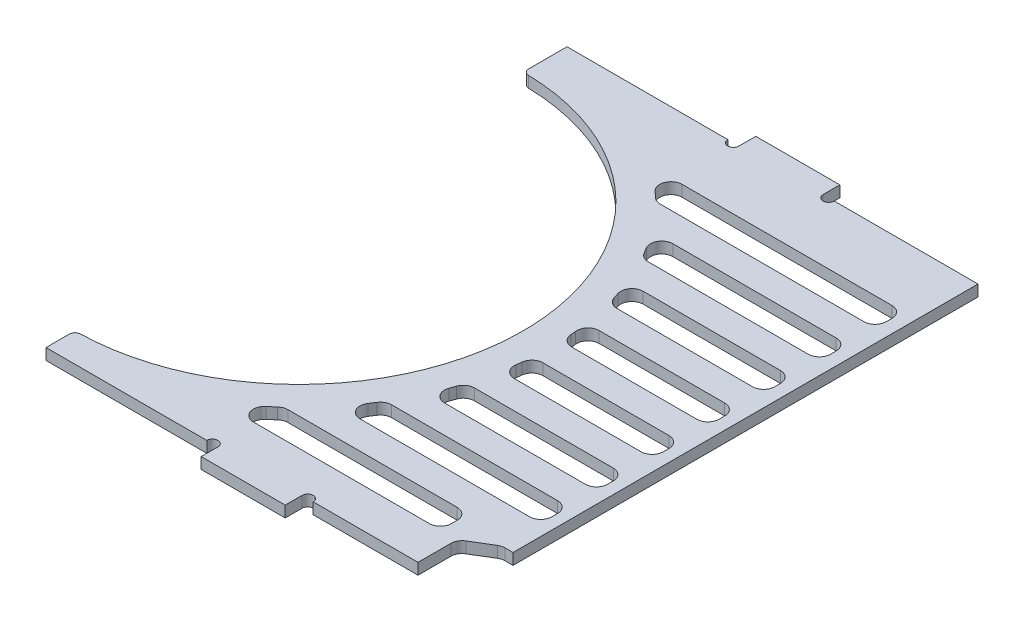
from build123d import *

# Parameters (mm, degrees)
EXTRUDE_1_DEPTH          = 2
SKETCH_3_W               = 76.4
SKETCH_3_H               = 2
EXTRUDE_2_DEPTH          = 7
CUT_EXTRUDE_1_DEPTH      = 10
EXTRUDE_4_DEPTH          = 2
PATTERN_LINEAR_2_COUNT   = 2
PATTERN_LINEAR_2_PITCH   = 32
FILLET_3_R               = 0.5
CUT_EXTRUDE_2_DEPTH      = 10
EXTRUDE_5_DEPTH          = 2
CUT_EXTRUDE_3_DEPTH      = 10
CUT_EXTRUDE_4_DEPTH      = 10
FILLET_5_R               = 2
EXTRUDE_9_DEPTH          = 2
FILLET_6_R               = 2
FILLET_7_R               = 1
SKETCH_18_W              = 76.4
SKETCH_18_H              = 2
EXTRUDE_6_DEPTH          = 2
SKETCH_19_W              = 10
SKETCH_19_H              = 10
CUT_EXTRUDE_5_DEPTH      = 63.552223465
EXTRUDE_8_DEPTH          = 2
FILLET_8_R               = 2
FILLET_9_R               = 2
SKETCH_21_W              = 3
SKETCH_21_H              = 87.342834434
CUT_EXTRUDE_6_DEPTH      = 63.552223465
CUT_EXTRUDE_7_DEPTH      = 63.484063073
CUT_EXTRUDE_7_DEPTH_BACK = 63.484063073
SKETCH_24_W              = 15
SKETCH_24_H              = 2
EXTRUDE_10_DEPTH         = 3
SKETCH_25_R              = 1
CUT_EXTRUDE_8_DEPTH      = 62.495223392


with BuildPart() as part:
    # 草图1 → 凸台-拉伸1 (new body)
    with BuildSketch(Plane(origin=(0, 0, 0), x_dir=(1, 0, 0), z_dir=(0, 1, 0))):
        with BuildLine():
            Line((-38.2, -42.69), (-38.2, -45.85))
            Line((-38.2, -45.85), (38.2, -45.85))
            Line((38.2, -45.85), (38.2, 45.85))
            Line((38.2, 45.85), (-38.2, 45.85))
            Line((-38.2, 45.85), (-38.2, 37.31))
            ThreePointArc((-38.2, 37.31), (1.8, -2.69), (-38.2, -42.69))
        make_face()
    extrude(amount=EXTRUDE_1_DEPTH)

    # 草图3 → 凸台-拉伸2 (add)
    with BuildSketch(Plane(origin=(0, 0, -45.85), x_dir=(-1, 0, 0), z_dir=(0, 0, -1))):
        with Locations((0, 1)):
            Rectangle(SKETCH_3_W, SKETCH_3_H)
    extrude(amount=EXTRUDE_2_DEPTH)

    # 草图5 → 切除-拉伸1 (cut)
    with BuildSketch(Plane(origin=(0, 2, 0), x_dir=(1, 0, 0), z_dir=(0, 1, 0))):
        Polygon((-38.2, 51.26), (38.2, 52.85), (-38.2, 52.85), align=None)
    extrude(amount=-CUT_EXTRUDE_1_DEPTH, mode=Mode.SUBTRACT)

    # 草图7 → 凸台-拉伸4 (add)
    with BuildSketch(Plane.XZ):
        Polygon((25.6, -52.587774869), (25.6, -54.754790576), (9.6, -54.754790576), (9.6, -52.254790576), align=None)
    extrude_4 = extrude(amount=-EXTRUDE_4_DEPTH)

    # 阵列(线性)2: 凸台-拉伸4 ×2
    with Locations(*[Vector(-0.9997835106742528, 0, 0.0208070128530375) * (i * PATTERN_LINEAR_2_PITCH) for i in range(1, PATTERN_LINEAR_2_COUNT)]):
        add(extrude_4)

    # 圆角3
    fillet_3_edges = [part.edges().sort_by_distance(p)[0] for p in [
        (25.6, 1, -54.754790576),
        (9.6, 1, -54.754790576),
        (-6.393072342, 1, -54.088966165),
        (-22.393072342, 1, -54.088966165),
    ]]
    fillet(fillet_3_edges, radius=FILLET_3_R)

    # 草图10 → 切除-拉伸2 (cut)
    with BuildSketch(Plane(origin=(0, 2, 0), x_dir=(1, 0, 0), z_dir=(0, 1, 0))):
        Polygon((-38.882265213, 53.905585721), (39.585789662, 55.538625083), (39.585789662, 48.538625083), (-38.2, 46.919784696), (-39.22769149, 52.889737929), align=None)
    extrude(amount=-CUT_EXTRUDE_2_DEPTH, mode=Mode.SUBTRACT)

    # 草图11 → 凸台-拉伸5 (add)
    with BuildSketch(Plane(origin=(0, 2, 0), x_dir=(1, 0, 0), z_dir=(0, 1, 0))):
        Polygon((-38.2, 46.919784696), (38.2, 49.509784696), (38.2, 48.509784696), align=None)
    extrude(amount=-EXTRUDE_5_DEPTH)

    # 草图13 → 切除-拉伸3 (cut)
    with BuildSketch(Plane.XZ):
        Polygon((38.2, -49.509784696), (37.7, -49.492834434), (38.2, 45.85), align=None)
    extrude(amount=-CUT_EXTRUDE_3_DEPTH, mode=Mode.SUBTRACT)

    # 草图16 → 切除-拉伸4 (cut)
    with BuildSketch(Plane.XZ):
        with BuildLine():
            ThreePointArc((-21.63159016, -39.14883119), (-26.948214114, -40.880601492), (-32.438562967, -41.939652064))
            Line((-32.438562967, -41.939652064), (32.727956442, -44.14883119))
            Line((32.727956442, -44.14883119), (32.754177605, -39.14883119))
            Line((32.754177605, -39.14883119), (-21.63159016, -39.14883119))
        make_face()
        with BuildLine():
            ThreePointArc((-6.399232266, -29.14883119), (-9.26951053, -31.777764346), (-12.35622867, -34.14883119))
            Line((-12.35622867, -34.14883119), (32.780398767, -34.14883119))
            Line((32.780398767, -34.14883119), (32.80661993, -29.14883119))
            Line((32.80661993, -29.14883119), (-6.399232266, -29.14883119))
        make_face()
        with BuildLine():
            ThreePointArc((1.145462918, -19.14883119), (-0.38438284, -21.702193399), (-2.079685213, -24.14883119))
            Line((-2.079685213, -24.14883119), (32.832841093, -24.14883119))
            Line((32.832841093, -24.14883119), (32.859062256, -19.14883119))
            Line((32.859062256, -19.14883119), (1.145462918, -19.14883119))
        make_face()
        with BuildLine():
            ThreePointArc((5.214767949, -9.14883119), (4.446089194, -11.673532869), (3.530729255, -14.14883119))
            Line((3.530729255, -14.14883119), (32.885283419, -14.14883119))
            Line((32.885283419, -14.14883119), (32.911504582, -9.14883119))
            Line((32.911504582, -9.14883119), (5.214767949, -9.14883119))
        make_face()
        with BuildLine():
            Line((32.937725745, -4.14883119), (32.963946908, 0.85116881))
            Line((32.963946908, 0.85116881), (6.762414302, 0.85116881))
            ThreePointArc((6.762414302, 0.85116881), (6.58968308, -1.65560578), (6.277301941, -4.14883119))
            Line((6.277301941, -4.14883119), (32.937725745, -4.14883119))
        make_face()
        with BuildLine():
            Line((33.016389234, 10.85116881), (6.053760559, 10.85116881))
            ThreePointArc((6.053760559, 10.85116881), (6.441352349, 8.360067057), (6.688829476, 5.85116881))
            Line((6.688829476, 5.85116881), (32.990168071, 5.85116881))
            Line((32.990168071, 5.85116881), (33.016389234, 10.85116881))
        make_face()
        with BuildLine():
            Line((33.06883156, 20.85116881), (2.97246589, 20.85116881))
            ThreePointArc((2.97246589, 20.85116881), (3.976569254, 18.378754125), (4.832355682, 15.85116881))
            Line((4.832355682, 15.85116881), (33.042610397, 15.85116881))
            Line((33.042610397, 15.85116881), (33.06883156, 20.85116881))
        make_face()
        with BuildLine():
            Line((33.121273886, 30.85116881), (-3.100875064, 30.85116881))
            ThreePointArc((-3.100875064, 30.85116881), (-1.274777634, 28.410185715), (0.381864384, 25.85116881))
            Line((0.381864384, 25.85116881), (33.095052723, 25.85116881))
            Line((33.095052723, 25.85116881), (33.121273886, 30.85116881))
        make_face()
        with BuildLine():
            Line((33.173710083, 40.85), (-14.350169812, 40.85))
            ThreePointArc((-14.350169812, 40.85), (-10.950539992, 38.501547429), (-7.780649528, 35.85116881))
            Line((-7.780649528, 35.85116881), (33.147495049, 35.85116881))
            Line((33.147495049, 35.85116881), (33.173710083, 40.85))
        make_face()
    extrude(amount=-CUT_EXTRUDE_4_DEPTH, mode=Mode.SUBTRACT)

    # 圆角5
    fillet_5_edges = [part.edges().sort_by_distance(p)[0] for p in [
        (-21.63159016, 1, -39.14883119),
        (32.754177605, 1, -39.14883119),
        (32.727956442, 1, -44.14883119),
        (-6.399232266, 1, -29.14883119),
        (32.80661993, 1, -29.14883119),
        (32.780398767, 1, -34.14883119),
        (-2.079685213, 1, -24.14883119),
        (3.530729255, 1, -14.14883119),
        (5.214767949, 1, -9.14883119),
        (32.911504582, 1, -9.14883119),
        (32.885283419, 1, -14.14883119),
        (32.937725745, 1, -4.14883119),
        (6.688829476, 1, 5.85116881),
        (33.016389234, 1, 10.85116881),
        (32.990168071, 1, 5.85116881),
        (4.832355682, 1, 15.85116881),
        (2.97246589, 1, 20.85116881),
        (0.381864384, 1, 25.85116881),
        (-3.100875064, 1, 30.85116881),
        (33.121273886, 1, 30.85116881),
        (-14.350169812, 1, 40.85),
        (33.173710083, 1, 40.85),
    ]]
    fillet(fillet_5_edges, radius=FILLET_5_R)

    # 草图23 → 凸台-拉伸9 (add)
    with BuildSketch(Plane.XZ):
        with BuildLine():
            Line((30.743661638, -39.14883119), (-21.254296123, -39.14883119))
            ThreePointArc((-21.254296123, -39.14883119), (-21.621062836, -39.182748237), (-21.975389905, -39.283349012))
            ThreePointArc((-21.975389905, -39.283349012), (-27.127035015, -40.926389654), (-32.438562967, -41.939652064))
            Line((-32.438562967, -41.939652064), (30.67101495, -44.079099797))
            ThreePointArc((30.67101495, -44.079099797), (32.125051399, -43.521859473), (32.738749569, -42.090736373))
            Line((32.738749569, -42.090736373), (32.743634136, -41.159319511))
            ThreePointArc((32.743634136, -41.159319511), (32.161578532, -39.738330684), (30.743661638, -39.14883119))
        make_face()
    extrude(amount=-EXTRUDE_9_DEPTH)

    # 圆角6
    fillet_6_edges = [part.edges().sort_by_distance(p)[0] for p in [
        (-12.35622867, 1, -34.14883119),
        (1.145462918, 1, -19.14883119),
        (32.859062256, 1, -19.14883119),
        (32.832841093, 1, -24.14883119),
        (6.277301941, 1, -4.14883119),
        (6.762414302, 1, 0.85116881),
        (32.963946908, 1, 0.85116881),
        (6.053760559, 1, 10.85116881),
        (33.06883156, 1, 20.85116881),
        (33.042610397, 1, 15.85116881),
        (33.095052723, 1, 25.85116881),
        (-7.780649528, 1, 35.85116881),
        (33.147495049, 1, 35.85116881),
    ]]
    fillet(fillet_6_edges, radius=FILLET_6_R)

    # 圆角7
    fillet_7_edges = [part.edges().sort_by_distance(p)[0] for p in [
        (-38.2, 1, 42.69),
        (-38.2, 1, -37.31),
        (-38.2, 1, -46.919784696),
    ]]
    fillet(fillet_7_edges, radius=FILLET_7_R)

    # 草图18 → 凸台-拉伸6 (add)
    with BuildSketch(Plane.XY.offset(45.85)):
        with Locations((0, 1)):
            Rectangle(SKETCH_18_W, SKETCH_18_H)
    extrude(amount=EXTRUDE_6_DEPTH)

    # 草图19 → 切除-拉伸5 (cut, through all)
    with BuildSketch(Plane(origin=(0, 2, 0), x_dir=(1, 0, 0), z_dir=(0, 1, 0))):
        with Locations((33.2, -42.85)):
            Rectangle(SKETCH_19_W, SKETCH_19_H)
    extrude(amount=-CUT_EXTRUDE_5_DEPTH, mode=Mode.SUBTRACT)

    # 草图20 → 凸台-拉伸8 (add)
    with BuildSketch(Plane(origin=(0, 2, 0), x_dir=(1, 0, 0), z_dir=(0, 1, 0))):
        Polygon((25.2, -35.85116881), (33.157977385, -35.85116881), (33.157977385, -37.85), (28.2, -40.85), (25.2, -40.85), align=None)
    extrude(amount=-EXTRUDE_8_DEPTH)

    # 圆角8
    fillet_8_edges = [part.edges().sort_by_distance(p)[0] for p in [
        (25.2, 1, 40.85),
        (25.2, 1, 35.85116881),
    ]]
    fillet(fillet_8_edges, radius=FILLET_8_R)

    # 圆角9
    fillet_9_edges = [part.edges().sort_by_distance(p)[0] for p in [
        (33.157977385, 1, 37.85),
        (28.2, 1, 40.85),
    ]]
    fillet(fillet_9_edges, radius=FILLET_9_R)

    # 草图21 → 切除-拉伸6 (cut, through all)
    with BuildSketch(Plane.XZ):
        with Locations((36.658046139, -5.821417217)):
            Rectangle(SKETCH_21_W, SKETCH_21_H)
    extrude(amount=-CUT_EXTRUDE_6_DEPTH, mode=Mode.SUBTRACT)

    # 草图22 → 切除-拉伸7 (cut, two sides: drawn at the far end of the back side and taken through both)
    with BuildSketch(Plane.XZ.offset(-CUT_EXTRUDE_7_DEPTH_BACK)):
        Polygon((-290.579437235, -45.15), (-39.244125604, -45.15), (60.755874396, -45.15), (60.755874396, -51.15), (-39.244125604, -51.15), (-39.244125604, -47.15), (-39.244125604, 204.185311631), (314.77499341, -152.673510404), (63.439681778, -402.008822036), align=None)
    extrude(amount=CUT_EXTRUDE_7_DEPTH + CUT_EXTRUDE_7_DEPTH_BACK, mode=Mode.SUBTRACT)

    # 草图24 → 凸台-拉伸10 (add)
    with BuildSketch(Plane(origin=(0, 0, -45.15), x_dir=(-1, 0, 0), z_dir=(0, 0, -1))):
        with Locations((0, 1)):
            Rectangle(SKETCH_24_W, SKETCH_24_H)
    extrude_10 = extrude(amount=EXTRUDE_10_DEPTH)

    # 草图25 → 切除-拉伸8 (cut, through all)
    with BuildSketch(Plane(origin=(0, 2, 0), x_dir=(1, 0, 0), z_dir=(0, 1, 0))):
        with Locations((-8.5, 45.15)):
            Circle(SKETCH_25_R)
        with Locations((8.5, 45.15)):
            Circle(SKETCH_25_R)
    cut_extrude_8 = extrude(amount=-CUT_EXTRUDE_8_DEPTH, mode=Mode.SUBTRACT)

    # 镜向1: 凸台-拉伸10, 切除-拉伸8 across plane
    add(extrude_10.mirror(Plane.XY.offset(1.35)))
    add(cut_extrude_8.mirror(Plane.XY.offset(1.35)), mode=Mode.SUBTRACT)


solid = part.part
